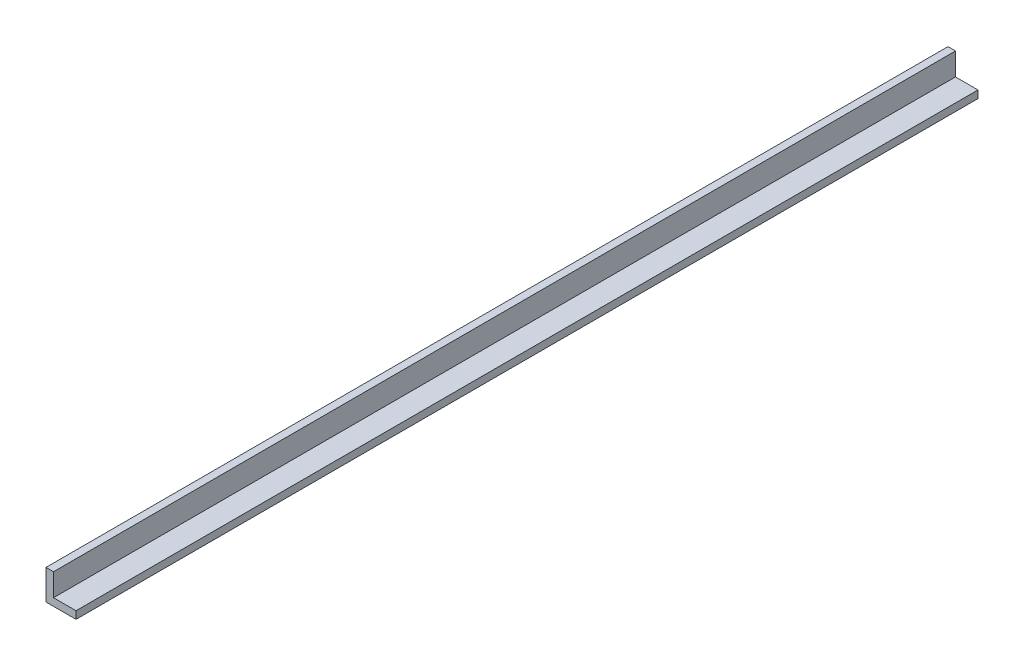
from build123d import *

# Parameters (mm, degrees)
SALIENTE_EXTRUIR1_DEPTH = 6100


with BuildPart() as part:
    # Croquis1 → Saliente-Extruir1 (new body)
    with BuildSketch(Plane.XY):
        Polygon((0, 203), (0, 0), (203, 0), (203, 50.8), (50.8, 50.8), (50.8, 203), align=None)
    extrude(amount=-SALIENTE_EXTRUIR1_DEPTH)


solid = part.part
